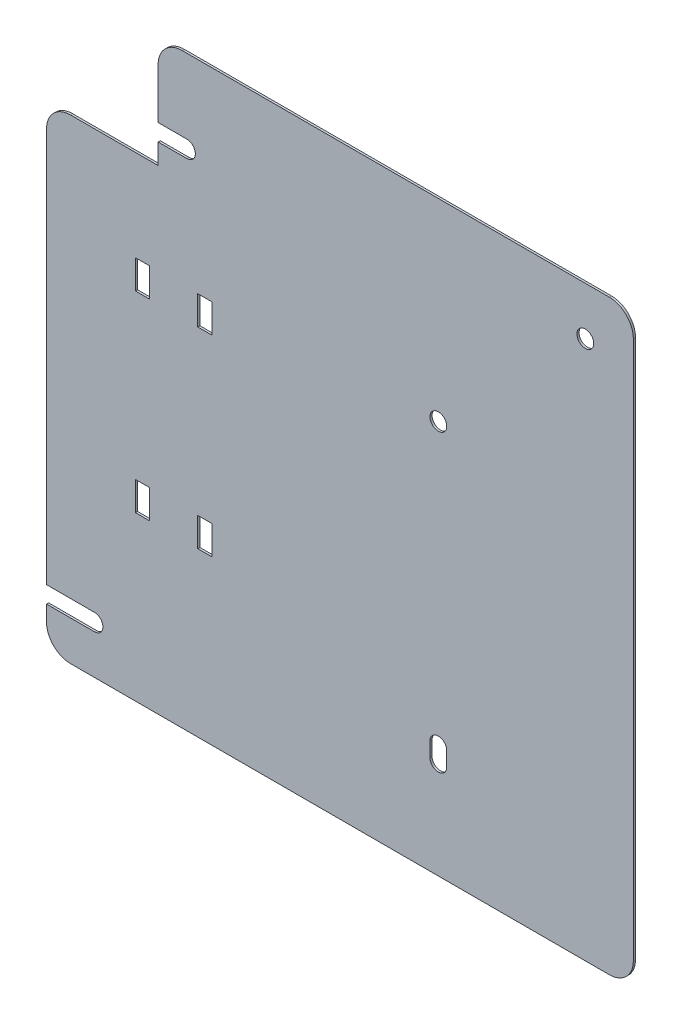
from build123d import *

# Parameters (mm, degrees)
BOSS_EXTRUDE1_DEPTH = 0.4445
SKETCH2_R           = 1.75
CUT_EXTRUDE1_DEPTH  = 204.647238086
FILLET1_R           = 5
SKETCH3_W           = 3
SKETCH3_H           = 6
CUT_EXTRUDE2_DEPTH  = 204.647238086


with BuildPart() as part:
    # Sketch1 → Boss-Extrude1 (new body)
    with BuildSketch(Plane.XY):
        Polygon((144, -21.75), (45, -21.75), (45, -45), (21.75, -45), (21.75, -144), (144, -144), align=None)
    extrude(amount=BOSS_EXTRUDE1_DEPTH)

    # Sketch2 → Cut-Extrude1 (cut, through all)
    with BuildSketch(Plane.XY.offset(0.4445)):
        with Locations((134, -31.75)):
            Circle(SKETCH2_R)
        with Locations((103.375, -62)):
            Circle(SKETCH2_R)
        with BuildLine():
            Line((51, -40.75), (45, -40.75))
            ThreePointArc((45, -40.75), (43.25, -39), (45, -37.25))
            Line((45, -37.25), (51, -37.25))
            ThreePointArc((51, -37.25), (52.75, -39), (51, -40.75))
        make_face()
        with BuildLine():
            Line((31.75, -135.75), (21.75, -135.75))
            ThreePointArc((21.75, -135.75), (20, -134), (21.75, -132.25))
            Line((21.75, -132.25), (31.75, -132.25))
            ThreePointArc((31.75, -132.25), (33.5, -134), (31.75, -135.75))
        make_face()
        with BuildLine():
            Line((101.625, -123.5), (101.625, -120.5))
            ThreePointArc((101.625, -120.5), (103.375, -118.75), (105.125, -120.5))
            Line((105.125, -120.5), (105.125, -123.5))
            ThreePointArc((105.125, -123.5), (103.375, -125.25), (101.625, -123.5))
        make_face()
    extrude(amount=-CUT_EXTRUDE1_DEPTH, mode=Mode.SUBTRACT)

    # Fillet1
    fillet1_edges = [part.edges().sort_by_distance(p)[0] for p in [
        (144, -144, 0.22225),
        (21.75, -144, 0.22225),
        (21.75, -45, 0.22225),
        (45, -21.75, 0.22225),
        (144, -21.75, 0.22225),
    ]]
    fillet(fillet1_edges, radius=FILLET1_R)

    # Sketch3 → Cut-Extrude2 (cut, through all)
    with BuildSketch(Plane(origin=(0, 0, 0), x_dir=(-1, 0, 0), z_dir=(0, 0, -1))):
        with Locations((-41.75, -67)):
            Rectangle(SKETCH3_W, SKETCH3_H)
        with Locations((-54.75, -67)):
            Rectangle(SKETCH3_W, SKETCH3_H)
        with Locations((-41.75, -107)):
            Rectangle(SKETCH3_W, SKETCH3_H)
        with Locations((-54.75, -107)):
            Rectangle(SKETCH3_W, SKETCH3_H)
    extrude(amount=-CUT_EXTRUDE2_DEPTH, mode=Mode.SUBTRACT)


solid = part.part
